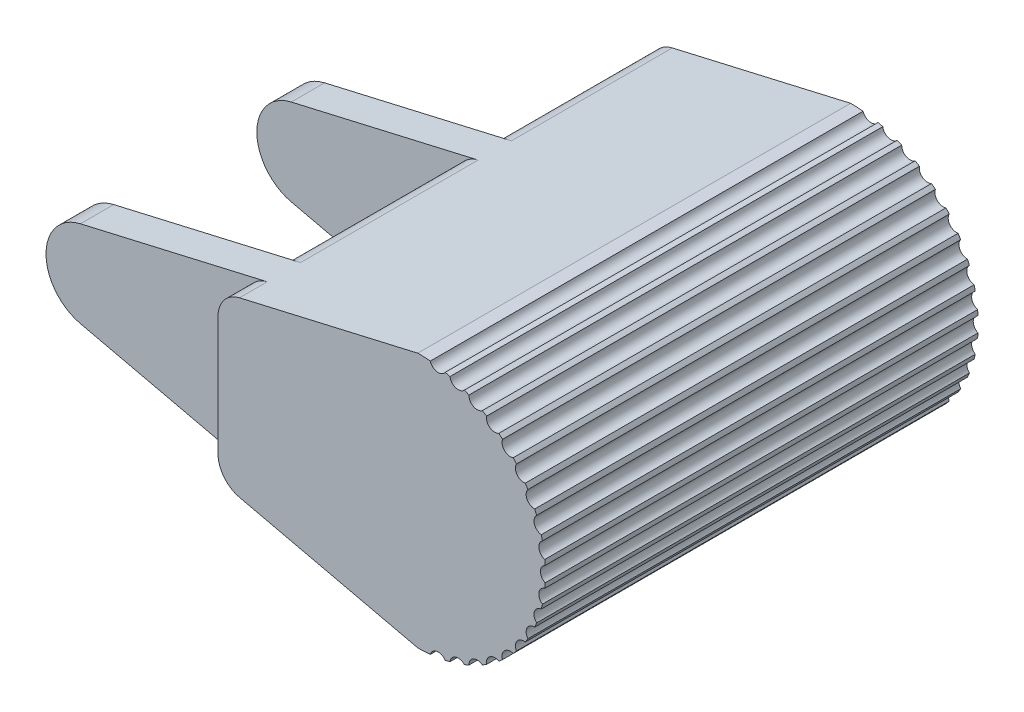
from build123d import *

# Parameters (mm, degrees)
RESSALTO_EXTRUS_O1_DEPTH            = 19.5
RESSALTO_EXTRUS_O2_START            = 17
RESSALTO_EXTRUS_O2_DEPTH            = 3
RESSALTO_EXTRUS_O3_START            = -2
RESSALTO_EXTRUS_O3_DEPTH            = 3
ESBO_O2_W                           = 14
ESBO_O2_H                           = 10
CORTE_EXTRUS_O1_DEPTH               = 13
ESBO_O4_R                           = 0.75
CORTE_EXTRUS_O2_DEPTH               = 51.5
PADR_OCIRCULAR1_COUNT               = 10
PADR_OCIRCULAR1_ANGLE               = 81
PADR_OCIRCULAR1_THE_OTHER_WAY_COUNT = 10
PADR_OCIRCULAR1_THE_OTHER_WAY_ANGLE = 81


with BuildPart() as part:
    # Esboço1 → Ressalto-extrusão1 (new, symmetric)
    with BuildSketch(Plane.XY):
        with BuildLine():
            Line((32, 11.5), (15.937130244, 7.788175995))
            ThreePointArc((15.937130244, 7.788175995), (14.543322409, 6.908453445), (14, 5.3523645))
            Line((14, 5.3523645), (14, -5.3523645))
            ThreePointArc((14, -5.3523645), (14.543322409, -6.908453445), (15.937130244, -7.788175995))
            Line((15.937130244, -7.788175995), (32, -11.5))
            ThreePointArc((32, -11.5), (43.5, 0), (32, 11.5))
        make_face()
    extrude(amount=RESSALTO_EXTRUS_O1_DEPTH, both=True)

    # Esboço1<3> → Ressalto-extrusão2 (add)
    with BuildSketch(Plane.XY.offset(RESSALTO_EXTRUS_O2_START)):
        with BuildLine():
            Line((15.937130244, 7.788175995), (-0.900591609, 3.897298392))
            ThreePointArc((-0.900591609, 3.897298392), (-4, 0), (-0.900591609, -3.897298392))
            Line((-0.900591609, -3.897298392), (15.937130244, -7.788175995))
            ThreePointArc((15.937130244, -7.788175995), (14.543322409, -6.908453445), (14, -5.3523645))
            Line((14, -5.3523645), (14, 5.3523645))
            ThreePointArc((14, 5.3523645), (14.543322409, 6.908453445), (15.937130244, 7.788175995))
        make_face()
    extrude(amount=-RESSALTO_EXTRUS_O2_DEPTH)

    # Esboço1<4> → Ressalto-extrusão3 (add)
    with BuildSketch(Plane.XY.offset(RESSALTO_EXTRUS_O3_START)):
        with BuildLine():
            Line((15.937130244, 7.788175995), (-0.900591609, 3.897298392))
            ThreePointArc((-0.900591609, 3.897298392), (-4, 0), (-0.900591609, -3.897298392))
            Line((-0.900591609, -3.897298392), (15.937130244, -7.788175995))
            ThreePointArc((15.937130244, -7.788175995), (14.543322409, -6.908453445), (14, -5.3523645))
            Line((14, -5.3523645), (14, 5.3523645))
            ThreePointArc((14, 5.3523645), (14.543322409, 6.908453445), (15.937130244, 7.788175995))
        make_face()
    extrude(amount=-RESSALTO_EXTRUS_O3_DEPTH)

    # Esboço2 → Corte-extrusão1 (cut)
    with BuildSketch(Plane.ZY.offset(-14)):
        with Locations((6, 0.0523645)):
            Rectangle(ESBO_O2_W, ESBO_O2_H)
    extrude(amount=-CORTE_EXTRUS_O1_DEPTH, mode=Mode.SUBTRACT)

    # Esboço4 → Corte-extrusão2 (cut, symmetric)
    with BuildSketch(Plane.XY):
        with Locations((43.8, 0)):
            Circle(ESBO_O4_R)
    corte_extrus_o2 = extrude(amount=CORTE_EXTRUS_O2_DEPTH, both=True, mode=Mode.SUBTRACT)

    # PadrãoCircular1: Corte-extrusão2 ×10 about axis
    padr_ocircular1_axis = Axis((32, 0, 19.5), (0, 0, 1))
    for i in range(1, PADR_OCIRCULAR1_COUNT):
        add(corte_extrus_o2.rotate(padr_ocircular1_axis, i * PADR_OCIRCULAR1_ANGLE / (PADR_OCIRCULAR1_COUNT - 1)), mode=Mode.SUBTRACT)

    # PadrãoCircular1 the other way: Corte-extrusão2 ×10 about axis
    padr_ocircular1_the_other_way_axis = Axis((32, 0, 19.5), (0, 0, -1))
    for i in range(1, PADR_OCIRCULAR1_THE_OTHER_WAY_COUNT):
        add(corte_extrus_o2.rotate(padr_ocircular1_the_other_way_axis, i * PADR_OCIRCULAR1_THE_OTHER_WAY_ANGLE / (PADR_OCIRCULAR1_THE_OTHER_WAY_COUNT - 1)), mode=Mode.SUBTRACT)


solid = part.part
